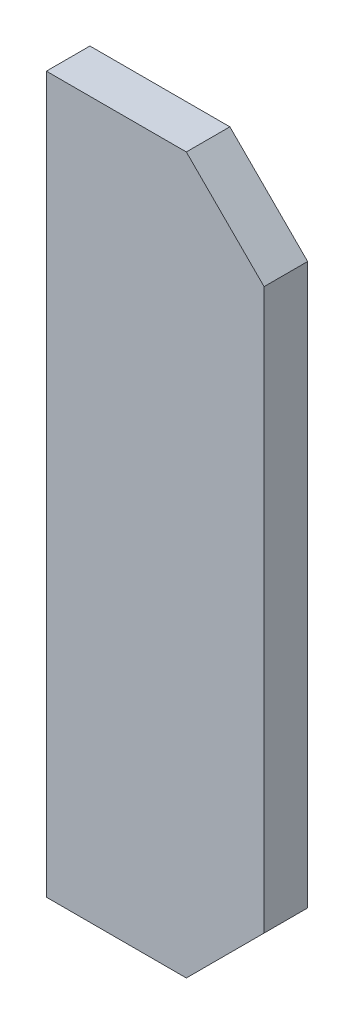
from build123d import *

# Parameters (mm, degrees)
EXTRUDE_392_DEPTH = 14


with BuildPart() as part:
    # 草图1 → Extrude 392 (new body)
    with BuildSketch(Plane.XY):
        Polygon((0, 0), (45, 0), (70, 25), (70, 205), (45, 230), (0, 230), align=None)
    extrude(amount=EXTRUDE_392_DEPTH)


solid = part.part
